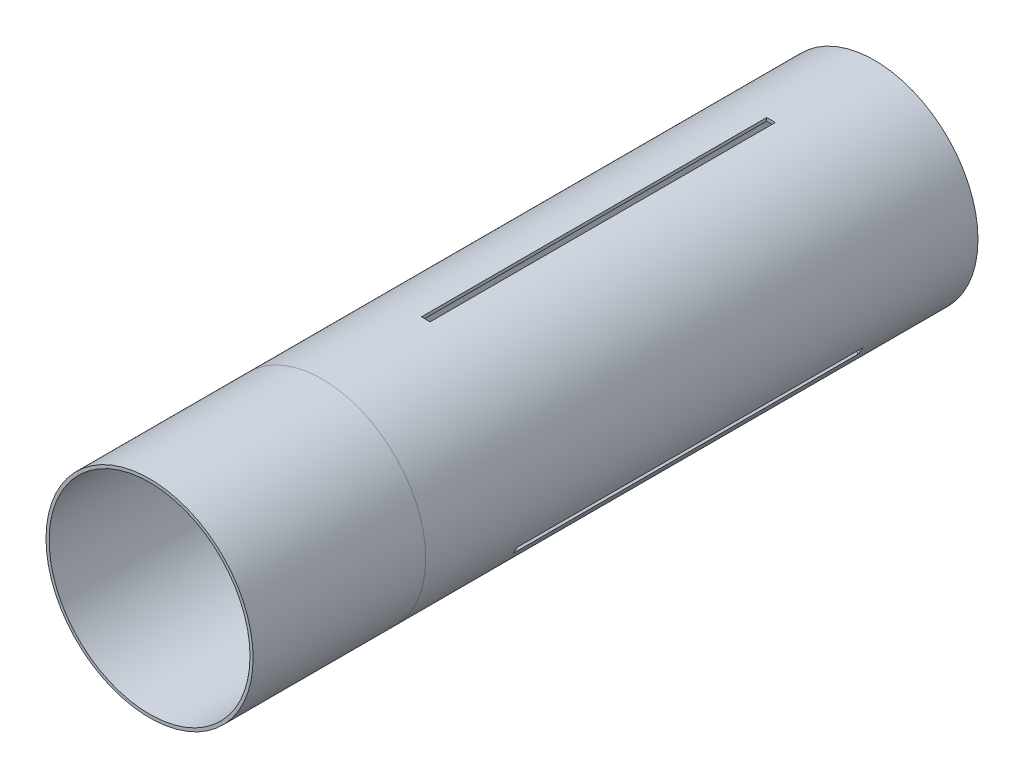
from build123d import *

# Parameters (mm, degrees)
ESQUISSE2_R                  = 76.1746
ESQUISSE2_R_2                = 73.914
BOSS_EXTRU_1_DEPTH           = 406.4
ESQUISSE3_R                  = 76.2
ESQUISSE3_R_2                = 73.914
BOSS_EXTRU_2_DEPTH           = 127
ESQUISSE4_W                  = 6.35
ESQUISSE4_H                  = 254
ENL_V_MAT_EXTRU_1_DEPTH      = 96.774
R_P_TITION_CIRCULAIRE1_COUNT = 3


with BuildPart() as part:
    # Esquisse2 → Boss.-Extru.1 (new body)
    with BuildSketch(Plane.XY):
        Circle(ESQUISSE2_R)
        Circle(ESQUISSE2_R_2, mode=Mode.SUBTRACT)
    extrude(amount=BOSS_EXTRU_1_DEPTH)

    # Esquisse3 → Boss.-Extru.2 (add)
    with BuildSketch(Plane.XY.offset(406.4)):
        Circle(ESQUISSE3_R)
        Circle(ESQUISSE3_R_2, mode=Mode.SUBTRACT)
    extrude(amount=BOSS_EXTRU_2_DEPTH)

    # Esquisse4 → Enlèv. mat.-Extru.1 (cut)
    with BuildSketch(Plane(origin=(0, 0, 0), x_dir=(1, 0, 0), z_dir=(0, 1, 0))):
        with Locations((0, -203.2)):
            Rectangle(ESQUISSE4_W, ESQUISSE4_H)
    enl_v_mat_extru_1 = extrude(amount=ENL_V_MAT_EXTRU_1_DEPTH, mode=Mode.SUBTRACT)

    # Répétition circulaire1: Enlèv. mat.-Extru.1 ×3 about axis
    r_p_tition_circulaire1_axis = Axis((0, 0, 0), (0, 0, 1))
    for i in range(1, R_P_TITION_CIRCULAIRE1_COUNT):
        add(enl_v_mat_extru_1.rotate(r_p_tition_circulaire1_axis, i * 360 / R_P_TITION_CIRCULAIRE1_COUNT), mode=Mode.SUBTRACT)


solid = part.part
